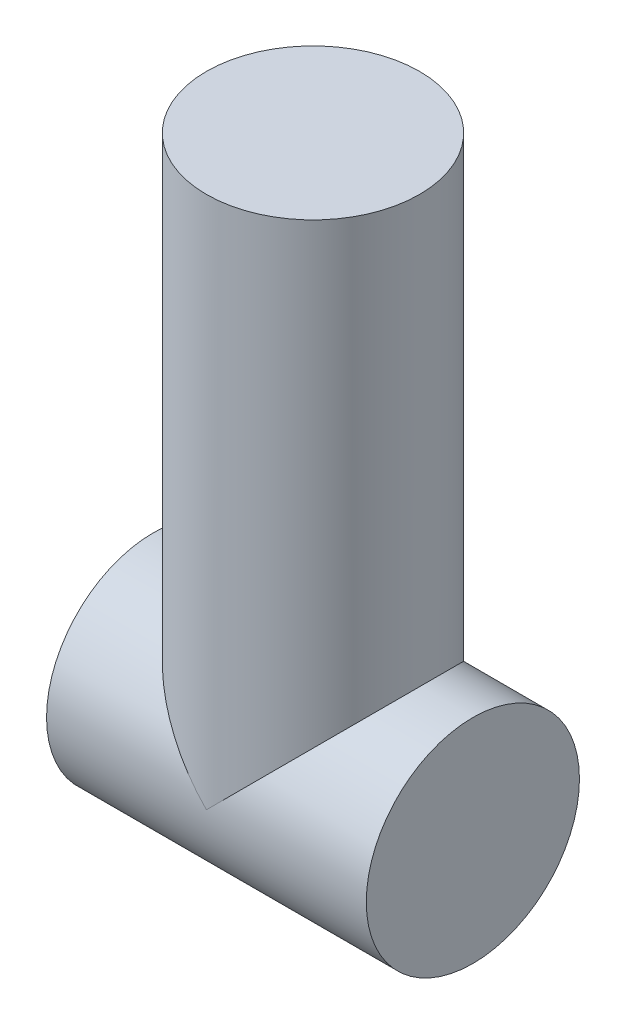
from build123d import *

# Parameters (mm, degrees)
SKETCH_1_R      = 20
EXTRUDE_1_DEPTH = 100
SKETCH_2_R      = 20
EXTRUDE_2_DEPTH = 30


with BuildPart() as part:
    # 草图1 → 凸台-拉伸1 (new body)
    with BuildSketch(Plane(origin=(0, 0, 0), x_dir=(1, 0, 0), z_dir=(0, 1, 0))):
        with Locations(Location((0, 0, 0), (0, 0, 270))):
            Circle(SKETCH_1_R)
    extrude(amount=EXTRUDE_1_DEPTH)

    # 草图2 → 凸台-拉伸2 (add, symmetric)
    with BuildSketch(Plane(origin=(0, 0, 0), x_dir=(0, 0, -1), z_dir=(1, 0, 0))):
        Circle(SKETCH_2_R)
    extrude(amount=EXTRUDE_2_DEPTH, both=True)


solid = part.part
